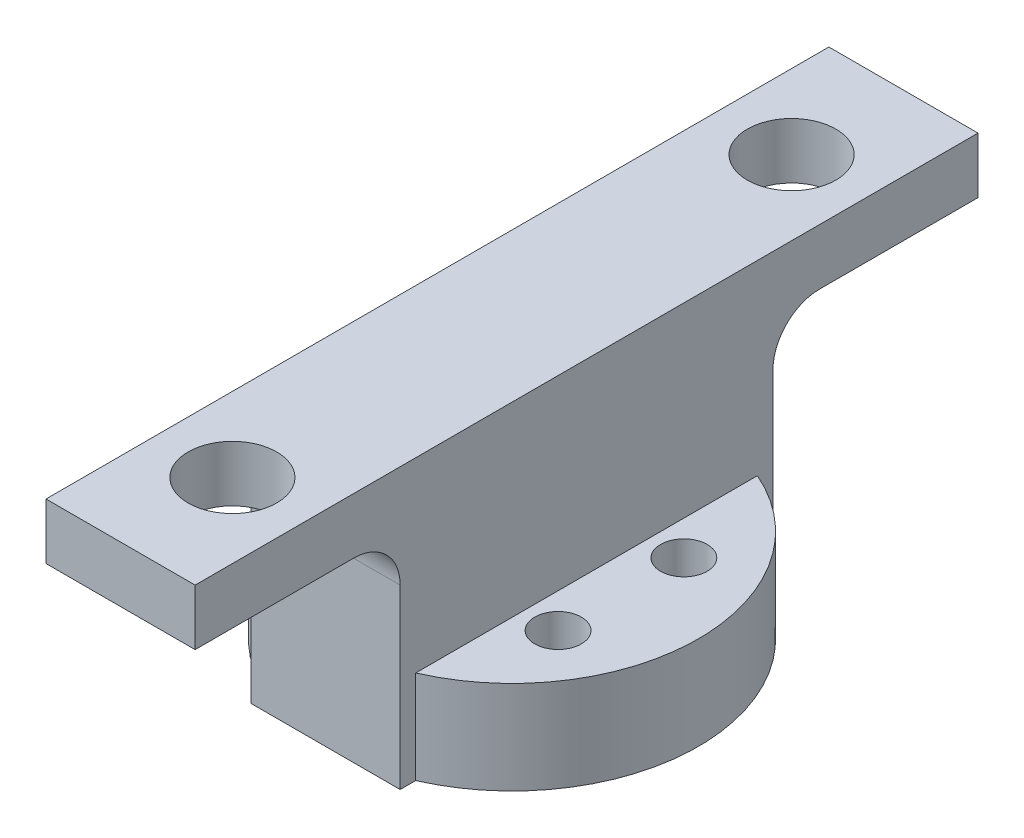
from build123d import *

# Parameters (mm, degrees)
SKETCH1_R           = 20
BOSS_EXTRUDE1_DEPTH = 10
SKETCH2_W           = 16
SKETCH2_H           = 40
BOSS_EXTRUDE2_DEPTH = 20
SKETCH3_W           = 16
SKETCH3_H           = 22
SKETCH3_R           = 4.75
BOSS_EXTRUDE3_DEPTH = 6
FILLET1_R           = 5
BOSS_EXTRUDE4_START = 10
BOSS_EXTRUDE4_DEPTH = 10


with BuildPart() as part:
    # Sketch1 → Boss-Extrude1 (new body)
    # profile 1 of 2: a face of its own
    with BuildSketch(Plane(origin=(0, 0, 0), x_dir=(1, 0, 0), z_dir=(0, 1, 0))):
        with Locations(Location((0, 0, 0), (0, 0, 270))):
            Circle(SKETCH1_R)
        with BuildLine():
            ThreePointArc((9.191342951, -6.75), (11.691342951, -9.25), (14.191342951, -6.75))
            ThreePointArc((14.191342951, -6.75), (11.691342951, -4.25), (9.191342951, -6.75))
        make_face(mode=Mode.SUBTRACT)
        with BuildLine():
            ThreePointArc((-2.5, -13.5), (0, -16), (2.5, -13.5))
            ThreePointArc((2.5, -13.5), (0, -11), (-2.5, -13.5))
        make_face(mode=Mode.SUBTRACT)
        with BuildLine():
            ThreePointArc((-14.191342951, -6.75), (-11.691342951, -9.25), (-9.191342951, -6.75))
            ThreePointArc((-9.191342951, -6.75), (-11.691342951, -4.25), (-14.191342951, -6.75))
        make_face(mode=Mode.SUBTRACT)
        with BuildLine():
            ThreePointArc((-14.191342951, 6.75), (-11.691342951, 4.25), (-9.191342951, 6.75))
            ThreePointArc((-9.191342951, 6.75), (-11.691342951, 9.25), (-14.191342951, 6.75))
        make_face(mode=Mode.SUBTRACT)
        with BuildLine():
            ThreePointArc((5.5, 0), (0, 5.5), (-5.5, 0))
            ThreePointArc((-5.5, 0), (0, -5.5), (5.5, 0))
        make_face(mode=Mode.SUBTRACT)
        with BuildLine():
            ThreePointArc((-2.5, 13.5), (0, 11), (2.5, 13.5))
            ThreePointArc((2.5, 13.5), (0, 16), (-2.5, 13.5))
        make_face(mode=Mode.SUBTRACT)
        with BuildLine():
            ThreePointArc((9.191342951, 6.75), (11.691342951, 4.25), (14.191342951, 6.75))
            ThreePointArc((14.191342951, 6.75), (11.691342951, 9.25), (9.191342951, 6.75))
        make_face(mode=Mode.SUBTRACT)
    # profile 2 of 2: a face of its own
    with BuildSketch(Plane(origin=(0, 0, 0), x_dir=(1, 0, 0), z_dir=(0, 1, 0))):
        with BuildLine():
            ThreePointArc((-5.5, 0), (0, -5.5), (5.5, 0))
            ThreePointArc((5.5, 0), (0, 5.5), (-5.5, 0))
        make_face()
    extrude(amount=BOSS_EXTRUDE1_DEPTH)

    # Sketch2 → Boss-Extrude2 (add)
    with BuildSketch(Plane(origin=(0, 10, 0), x_dir=(1, 0, 0), z_dir=(0, 1, 0))):
        Rectangle(SKETCH2_W, SKETCH2_H)
    extrude(amount=BOSS_EXTRUDE2_DEPTH)

    # Sketch3 → Boss-Extrude3 (add)
    # profile 1 of 2: a face of its own
    with BuildSketch(Plane(origin=(0, 30, 0), x_dir=(1, 0, 0), z_dir=(0, 1, 0))):
        with Locations((0, -31)):
            Rectangle(SKETCH3_W, SKETCH3_H)
        with Locations(Location((0, -30, 0), (0, 0, 270))):
            Circle(SKETCH3_R, mode=Mode.SUBTRACT)
    # profile 2 of 2: a face of its own
    with BuildSketch(Plane(origin=(0, 30, 0), x_dir=(1, 0, 0), z_dir=(0, 1, 0))):
        with Locations((0, 31)):
            Rectangle(SKETCH3_W, SKETCH3_H)
        with Locations(Location((0, 30, 0), (0, 0, 270))):
            Circle(SKETCH3_R, mode=Mode.SUBTRACT)
    extrude(amount=-BOSS_EXTRUDE3_DEPTH)

    # Fillet1
    fillet1_edges = [part.edges().sort_by_distance(p)[0] for p in [
        (0, 24, 20),
        (0, 24, -20),
    ]]
    fillet(fillet1_edges, radius=FILLET1_R)

    # Sketch4 → Boss-Extrude4 (add)
    with BuildSketch(Plane.XZ.offset(-10).offset(BOSS_EXTRUDE4_START)):
        with BuildLine():
            Line((-8, -18.33030278), (-8, -20))
            Line((-8, -20), (0, -20))
            ThreePointArc((0, -20), (-4.086192874, -19.578126259), (-8, -18.33030278))
        make_face()
        with BuildLine():
            ThreePointArc((8, -18.33030278), (4.086192874, -19.578126259), (0, -20))
            Line((0, -20), (8, -20))
            Line((8, -20), (8, -18.33030278))
        make_face()
        with BuildLine():
            Line((8, 18.33030278), (8, 20))
            Line((8, 20), (0, 20))
            ThreePointArc((0, 20), (4.086192874, 19.578126259), (8, 18.33030278))
        make_face()
        with BuildLine():
            ThreePointArc((-8, 18.33030278), (-4.086192874, 19.578126259), (0, 20))
            Line((0, 20), (-8, 20))
            Line((-8, 20), (-8, 18.33030278))
        make_face()
    extrude(amount=-BOSS_EXTRUDE4_DEPTH)


solid = part.part
